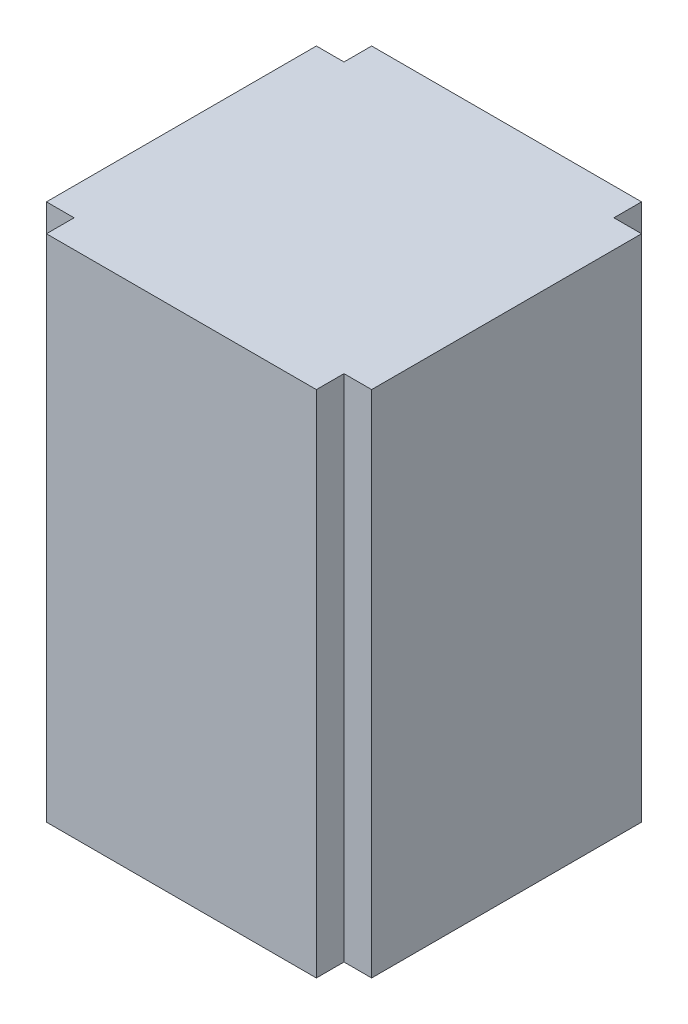
from build123d import *

# Parameters (mm, degrees)
BOSS_EXTRUDE1_DEPTH = 78.35


with BuildPart() as part:
    # Sketch1 → Boss-Extrude1 (new, symmetric)
    with BuildSketch(Plane(origin=(0, 0, 0), x_dir=(1, 0, 0), z_dir=(0, 1, 0))):
        Polygon((-34.915150203, 45.052454133), (-34.915150203, 53.552454133), (48.084849797, 53.552454133), (48.084849797, 45.052454133), (56.584849797, 45.052454133), (56.584849797, -37.947545867), (48.084849797, -37.947545867), (48.084849797, -46.447545867), (-34.915150203, -46.447545867), (-34.915150203, -37.947545867), (-43.415150203, -37.947545867), (-43.415150203, 45.052454133), align=None)
    extrude(amount=BOSS_EXTRUDE1_DEPTH, both=True)


solid = part.part
